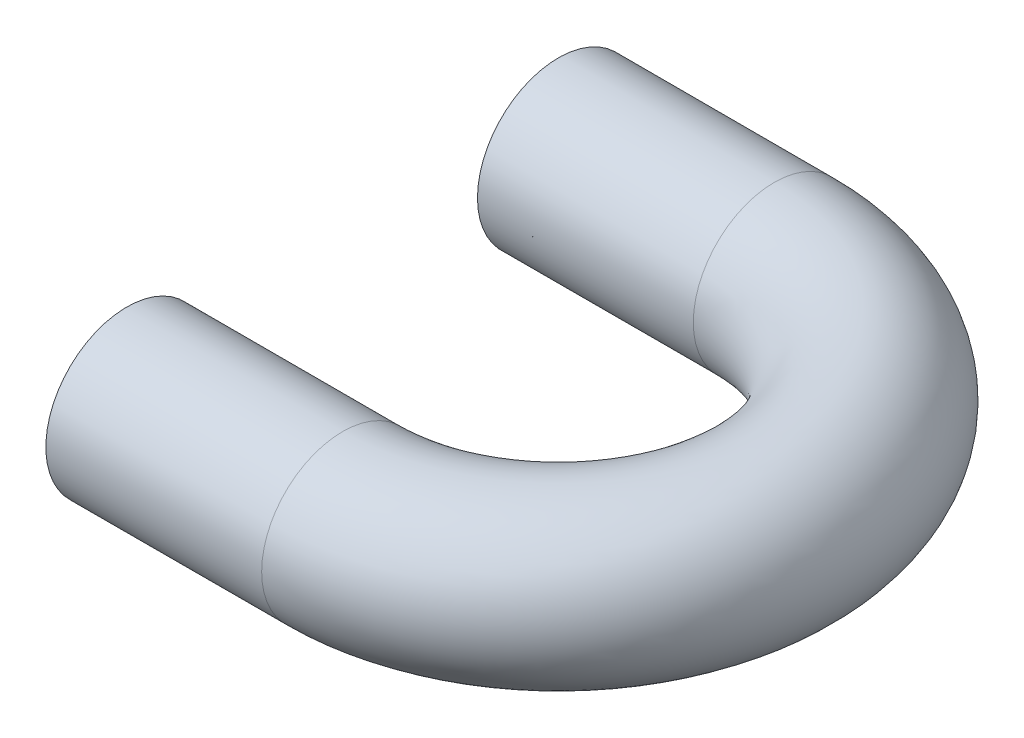
from build123d import *

# Parameters (mm, degrees)
SKETCH_1_R   = 7.5
SKETCH_1_R_2 = 5.7


with BuildPart() as part:
    # 扫描1: sweep along a path in 草图2
    with BuildLine(Plane(origin=(0, 0, 0), x_dir=(1, 0, 0), z_dir=(0, 1, 0))) as sweep_1_path:
        Line((0, 0), (20, 0))
        ThreePointArc((20, 0), (40, 20), (20, 40))
        Line((20, 40), (0, 40))
    # 草图1 → 扫描1 (sweep)
    with BuildSketch(Plane(origin=(0, 0, 0), x_dir=(0, 0, -1), z_dir=(1, 0, 0))):
        Circle(SKETCH_1_R)
        Circle(SKETCH_1_R_2, mode=Mode.SUBTRACT)
    sweep(path=sweep_1_path.line)


solid = part.part
